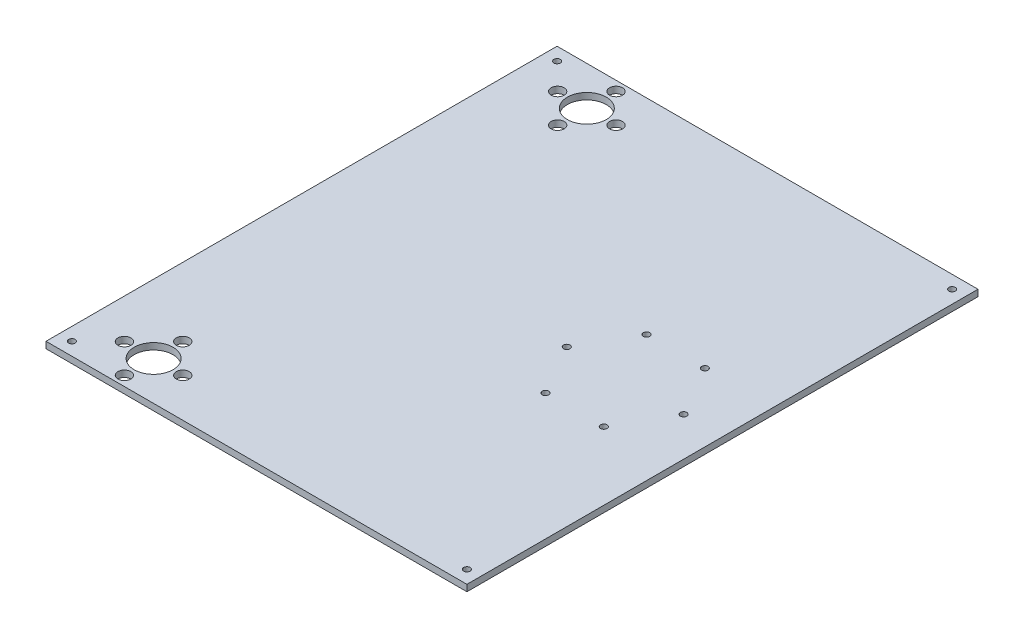
from build123d import *

# Parameters (mm, degrees)
SKETCH1_W           = 324.5
SKETCH1_H           = 394
BOSS_EXTRUDE1_DEPTH = 5
SKETCH2_R           = 2.5
CUT_EXTRUDE1_DEPTH  = 256.262732298
SKETCH3_R           = 2.5
CUT_EXTRUDE2_DEPTH  = 5
SKETCH4_R           = 15
SKETCH4_R_2         = 5
CUT_EXTRUDE4_DEPTH  = 256.262732298


with BuildPart() as part:
    # Sketch1 → Boss-Extrude1 (new body)
    with BuildSketch(Plane(origin=(0, 0, 0), x_dir=(1, 0, 0), z_dir=(0, 1, 0))):
        Rectangle(SKETCH1_W, SKETCH1_H)
    extrude(amount=BOSS_EXTRUDE1_DEPTH)

    # Sketch2 → Cut-Extrude1 (cut, through all)
    with BuildSketch(Plane(origin=(0, 5, 0), x_dir=(1, 0, 0), z_dir=(0, 1, 0))):
        with Locations(Location((152.25, 187, 0), (0, 0, 270))):
            Circle(SKETCH2_R)
        with Locations(Location((-152.25, 187, 0), (0, 0, 270))):
            Circle(SKETCH2_R)
        with Locations(Location((-152.25, -187, 0), (0, 0, 270))):
            Circle(SKETCH2_R)
        with Locations(Location((152.25, -187, 0), (0, 0, 270))):
            Circle(SKETCH2_R)
    extrude(amount=-CUT_EXTRUDE1_DEPTH, mode=Mode.SUBTRACT)

    # Sketch3 → Cut-Extrude2 (cut)
    with BuildSketch(Plane(origin=(0, 5, 0), x_dir=(1, 0, 0), z_dir=(0, 1, 0))):
        with Locations(Location((132.25, 0, 0), (0, 0, 270))):
            Circle(SKETCH3_R)
        with Locations(Location((109.75, -38.97114317, 0), (0, 0, 270))):
            Circle(SKETCH3_R)
        with Locations(Location((64.75, -38.97114317, 0), (0, 0, 270))):
            Circle(SKETCH3_R)
        with Locations(Location((42.25, 0, 0), (0, 0, 270))):
            Circle(SKETCH3_R)
        with Locations(Location((64.75, 38.97114317, 0), (0, 0, 270))):
            Circle(SKETCH3_R)
        with Locations(Location((109.75, 38.97114317, 0), (0, 0, 270))):
            Circle(SKETCH3_R)
    extrude(amount=-CUT_EXTRUDE2_DEPTH, mode=Mode.SUBTRACT)

    # Sketch4 → Cut-Extrude4 (cut, through all)
    with BuildSketch(Plane(origin=(0, 5, 0), x_dir=(1, 0, 0), z_dir=(0, 1, 0))):
        with Locations(Location((-109.31, 167, 0), (0, 0, 270))):
            Circle(SKETCH4_R)
        with Locations(Location((-109.31, -167, 0), (0, 0, 270))):
            Circle(SKETCH4_R)
        with Locations(Location((-109.31, 189.5, 0), (0, 0, 270))):
            Circle(SKETCH4_R_2)
        with Locations(Location((-109.31, -189.5, 0), (0, 0, 270))):
            Circle(SKETCH4_R_2)
        with Locations(Location((-131.81, -167, 0), (0, 0, 270))):
            Circle(SKETCH4_R_2)
        with Locations(Location((-109.31, -144.5, 0), (0, 0, 270))):
            Circle(SKETCH4_R_2)
        with Locations(Location((-86.81, -167, 0), (0, 0, 270))):
            Circle(SKETCH4_R_2)
        with Locations(Location((-86.81, 167, 0), (0, 0, 270))):
            Circle(SKETCH4_R_2)
        with Locations(Location((-109.31, 144.5, 0), (0, 0, 270))):
            Circle(SKETCH4_R_2)
        with Locations(Location((-131.81, 167, 0), (0, 0, 270))):
            Circle(SKETCH4_R_2)
    extrude(amount=-CUT_EXTRUDE4_DEPTH, mode=Mode.SUBTRACT)


solid = part.part
